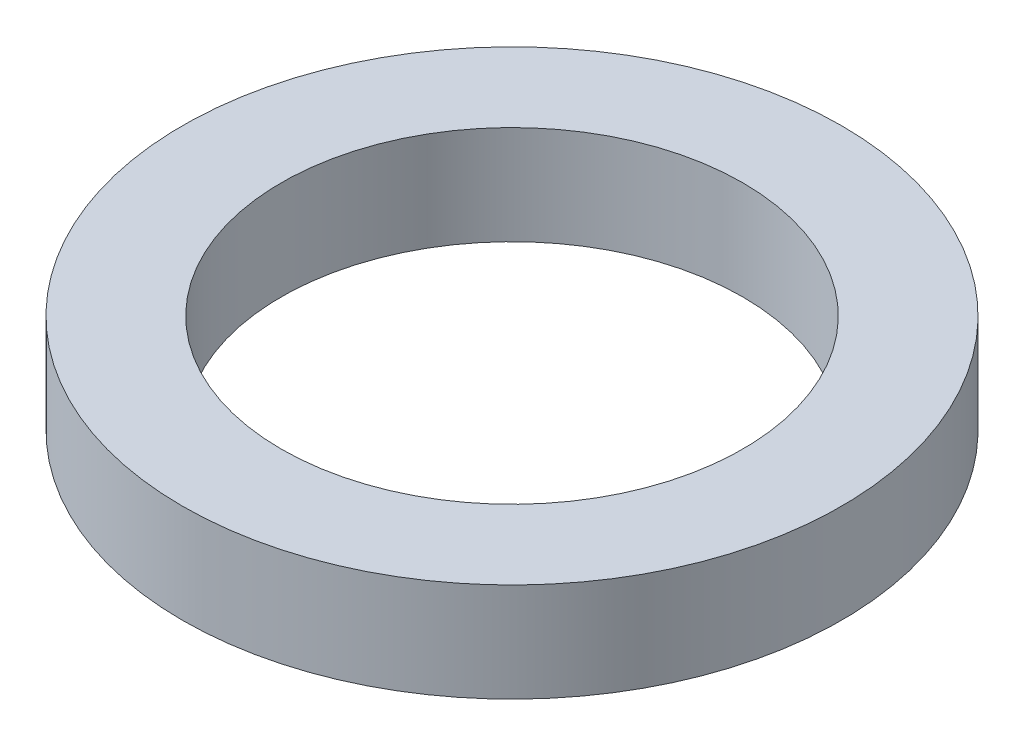
from build123d import *

# Parameters (mm, degrees)
SKETCH1_R           = 5
SKETCH1_R_2         = 3.5005
BOSS_EXTRUDE1_DEPTH = 1.5


with BuildPart() as part:
    # Sketch1 → Boss-Extrude1 (new body)
    with BuildSketch(Plane(origin=(0, 0, 0), x_dir=(1, 0, 0), z_dir=(0, 1, 0))):
        with Locations(Location((0, 0, 0), (0, 0, 270))):
            Circle(SKETCH1_R)
        with Locations(Location((0, 0, 0), (0, 0, 270))):
            Circle(SKETCH1_R_2, mode=Mode.SUBTRACT)
    extrude(amount=BOSS_EXTRUDE1_DEPTH)


solid = part.part
